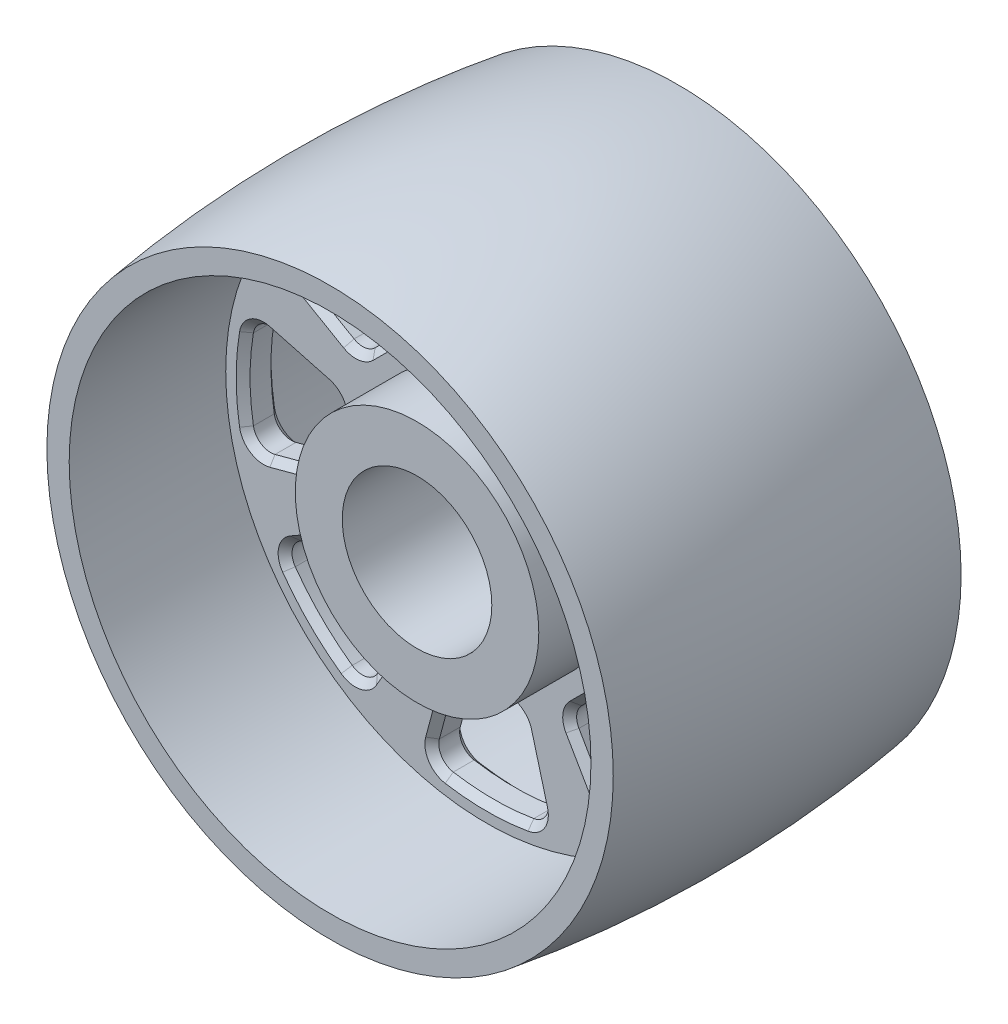
from build123d import *

# Parameters (mm, degrees)
CUT_EXTRUDE1_REACH           = 266.386
FILLET1_R                    = 10
CHAMFER1_SIZE                = 4
CIRPATTERN1_COUNT            = 8
FILLET1_OF_CIRPATTERN1_R     = 10
CHAMFER1_OF_CIRPATTERN1_SIZE = 4


with BuildPart() as part:
    # Sketch1 → Revolve1 (revolve)
    with BuildSketch(Plane(origin=(0, 0, 0), x_dir=(0, 0, -1), z_dir=(1, 0, 0)), mode=Mode.PRIVATE) as revolve1_sk:
        with BuildLine():
            Line((-50, 43), (50, 43))
            Line((50, 43), (50, 70))
            Line((50, 70), (10, 70))
            Line((10, 70), (10, 150))
            Line((10, 150), (100, 150))
            Line((100, 150), (100, 162.820323028))
            ThreePointArc((100, 162.820323028), (0, 170), (-100, 162.820323028))
            Line((-100, 162.820323028), (-100, 150))
            Line((-100, 150), (-10, 150))
            Line((-10, 150), (-10, 70))
            Line((-10, 70), (-50, 70))
            Line((-50, 70), (-50, 43))
        make_face()
    revolve(revolve1_sk.sketch.rotate(Axis((0, 0, 0), (0, 0, -1)), 90), axis=Axis((0, 0, 0), (0, 0, -1)))

    # Sketch3 → Cut-Extrude1 (cut, up to next)
    with BuildSketch(Plane.XY.offset(10), mode=Mode.PRIVATE) as cut_extrude1_sk1:
        with BuildLine():
            Line((-20, 84), (20, 84))
            Line((20, 84), (33.889496341, 135.836306037))
            ThreePointArc((33.889496341, 135.836306037), (0, 140), (-33.889496341, 135.836306037))
            Line((-33.889496341, 135.836306037), (-20, 84))
        make_face()
    cut_extrude1_tool1 = extrude(cut_extrude1_sk1.sketch, amount=-CUT_EXTRUDE1_REACH, mode=Mode.PRIVATE) & part.part
    cut_extrude1 = cut_extrude1_tool1.solids().sort_by_distance((0, 113.749571, 10))[0]
    add(cut_extrude1, mode=Mode.SUBTRACT)

    # Fillet1
    fillet1_edges = [part.edges().sort_by_distance(p)[0] for p in [
        (-20, 84, 0),
        (-33.889496341, 135.836306037, 0),
        (33.889496341, 135.836306037, 0),
        (20, 84, 0),
    ]]
    fillet(fillet1_edges, radius=FILLET1_R)

    # Chamfer1
    chamfer1_edges = [part.edges().sort_by_distance(p)[0] for p in [
        (26.569376904, 108.517248378, -10),
        (26.569376904, 108.517248378, 10),
        (0, 84, -10),
        (0, 84, 10),
        (-26.569376904, 108.517248378, -10),
        (-26.569376904, 108.517248378, 10),
        (0, 140, -10),
        (0, 140, 10),
        (18.41434441, 86.066466597, 10),
        (18.41434441, 86.066466597, -10),
        (-18.41434441, 86.066466597, 10),
        (-18.41434441, 86.066466597, -10),
        (29.904684491, 133.619398336, 10),
        (29.904684491, 133.619398336, -10),
        (-29.904684491, 133.619398336, 10),
        (-29.904684491, 133.619398336, -10),
    ]]
    chamfer(chamfer1_edges, length=CHAMFER1_SIZE)

    # CirPattern1: Cut-Extrude1 ×8 about axis
    cirpattern1_axis = Axis((0, 0, 0), (0, 0, 1))
    for i in range(1, CIRPATTERN1_COUNT):
        add(cut_extrude1.rotate(cirpattern1_axis, i * 360 / CIRPATTERN1_COUNT), mode=Mode.SUBTRACT)

    # Fillet1 of CirPattern1
    fillet1_of_cirpattern1_edges = [part.edges().sort_by_distance(p)[0] for p in [
        (-73.539105243, 45.254833996, 0),
        (-120.014265804, 72.087280456, 0),
        (-72.087280456, 120.014265804, 0),
        (-45.254833996, 73.539105243, 0),
        (-84, -20, 0),
        (-135.836306037, -33.889496341, 0),
        (-135.836306037, 33.889496341, 0),
        (-84, 20, 0),
        (-45.254833996, -73.539105243, 0),
        (-72.087280456, -120.014265804, 0),
        (-120.014265804, -72.087280456, 0),
        (-73.539105243, -45.254833996, 0),
        (20, -84, 0),
        (33.889496341, -135.836306037, 0),
        (-33.889496341, -135.836306037, 0),
        (-20, -84, 0),
        (73.539105243, -45.254833996, 0),
        (120.014265804, -72.087280456, 0),
        (72.087280456, -120.014265804, 0),
        (45.254833996, -73.539105243, 0),
        (84, 20, 0),
        (135.836306037, 33.889496341, 0),
        (135.836306037, -33.889496341, 0),
        (84, -20, 0),
        (45.254833996, 73.539105243, 0),
        (72.087280456, 120.014265804, 0),
        (120.014265804, 72.087280456, 0),
        (73.539105243, 45.254833996, 0),
    ]]
    fillet(fillet1_of_cirpattern1_edges, radius=FILLET1_OF_CIRPATTERN1_R)

    # Chamfer1 of CirPattern1
    chamfer1_of_cirpattern1_edges = [part.edges().sort_by_distance(p)[0] for p in [
        (-57.945895623, 95.520668784, -10),
        (-57.945895623, 95.520668784, 10),
        (-59.39696962, 59.39696962, -10),
        (-59.39696962, 59.39696962, 10),
        (-95.520668784, 57.945895623, -10),
        (-95.520668784, 57.945895623, 10),
        (-98.994949366, 98.994949366, -10),
        (-98.994949366, 98.994949366, 10),
        (-47.83727436, 73.879089967, 10),
        (-47.83727436, 73.879089967, -10),
        (-73.879089967, 47.83727436, 10),
        (-73.879089967, 47.83727436, -10),
        (-73.337377469, 115.628987855, 10),
        (-73.337377469, 115.628987855, -10),
        (-115.628987855, 73.337377469, 10),
        (-115.628987855, 73.337377469, -10),
        (-108.517248378, 26.569376904, -10),
        (-108.517248378, 26.569376904, 10),
        (-84, 0, -10),
        (-84, 0, 10),
        (-108.517248378, -26.569376904, -10),
        (-108.517248378, -26.569376904, 10),
        (-140, 0, -10),
        (-140, 0, 10),
        (-86.066466597, 18.41434441, 10),
        (-86.066466597, 18.41434441, -10),
        (-86.066466597, -18.41434441, 10),
        (-86.066466597, -18.41434441, -10),
        (-133.619398336, 29.904684491, 10),
        (-133.619398336, 29.904684491, -10),
        (-133.619398336, -29.904684491, 10),
        (-133.619398336, -29.904684491, -10),
        (-95.520668784, -57.945895623, -10),
        (-95.520668784, -57.945895623, 10),
        (-59.39696962, -59.39696962, -10),
        (-59.39696962, -59.39696962, 10),
        (-57.945895623, -95.520668784, -10),
        (-57.945895623, -95.520668784, 10),
        (-98.994949366, -98.994949366, -10),
        (-98.994949366, -98.994949366, 10),
        (-73.879089967, -47.83727436, 10),
        (-73.879089967, -47.83727436, -10),
        (-47.83727436, -73.879089967, 10),
        (-47.83727436, -73.879089967, -10),
        (-115.628987855, -73.337377469, 10),
        (-115.628987855, -73.337377469, -10),
        (-73.337377469, -115.628987855, 10),
        (-73.337377469, -115.628987855, -10),
        (-26.569376904, -108.517248378, -10),
        (-26.569376904, -108.517248378, 10),
        (0, -84, -10),
        (0, -84, 10),
        (26.569376904, -108.517248378, -10),
        (26.569376904, -108.517248378, 10),
        (0, -140, -10),
        (0, -140, 10),
        (-18.41434441, -86.066466597, 10),
        (-18.41434441, -86.066466597, -10),
        (18.41434441, -86.066466597, 10),
        (18.41434441, -86.066466597, -10),
        (-29.904684491, -133.619398336, 10),
        (-29.904684491, -133.619398336, -10),
        (29.904684491, -133.619398336, 10),
        (29.904684491, -133.619398336, -10),
        (57.945895623, -95.520668784, -10),
        (57.945895623, -95.520668784, 10),
        (59.39696962, -59.39696962, -10),
        (59.39696962, -59.39696962, 10),
        (95.520668784, -57.945895623, -10),
        (95.520668784, -57.945895623, 10),
        (98.994949366, -98.994949366, -10),
        (98.994949366, -98.994949366, 10),
        (47.83727436, -73.879089967, 10),
        (47.83727436, -73.879089967, -10),
        (73.879089967, -47.83727436, 10),
        (73.879089967, -47.83727436, -10),
        (73.337377469, -115.628987855, 10),
        (73.337377469, -115.628987855, -10),
        (115.628987855, -73.337377469, 10),
        (115.628987855, -73.337377469, -10),
        (108.517248378, -26.569376904, -10),
        (108.517248378, -26.569376904, 10),
        (84, 0, -10),
        (84, 0, 10),
        (108.517248378, 26.569376904, -10),
        (108.517248378, 26.569376904, 10),
        (140, 0, -10),
        (140, 0, 10),
        (86.066466597, -18.41434441, 10),
        (86.066466597, -18.41434441, -10),
        (86.066466597, 18.41434441, 10),
        (86.066466597, 18.41434441, -10),
        (133.619398336, -29.904684491, 10),
        (133.619398336, -29.904684491, -10),
        (133.619398336, 29.904684491, 10),
        (133.619398336, 29.904684491, -10),
        (95.520668784, 57.945895623, -10),
        (95.520668784, 57.945895623, 10),
        (59.39696962, 59.39696962, -10),
        (59.39696962, 59.39696962, 10),
        (57.945895623, 95.520668784, -10),
        (57.945895623, 95.520668784, 10),
        (98.994949366, 98.994949366, -10),
        (98.994949366, 98.994949366, 10),
        (73.879089967, 47.83727436, 10),
        (73.879089967, 47.83727436, -10),
        (47.83727436, 73.879089967, 10),
        (47.83727436, 73.879089967, -10),
        (115.628987855, 73.337377469, 10),
        (115.628987855, 73.337377469, -10),
        (73.337377469, 115.628987855, 10),
        (73.337377469, 115.628987855, -10),
    ]]
    chamfer(chamfer1_of_cirpattern1_edges, length=CHAMFER1_OF_CIRPATTERN1_SIZE)


solid = part.part
